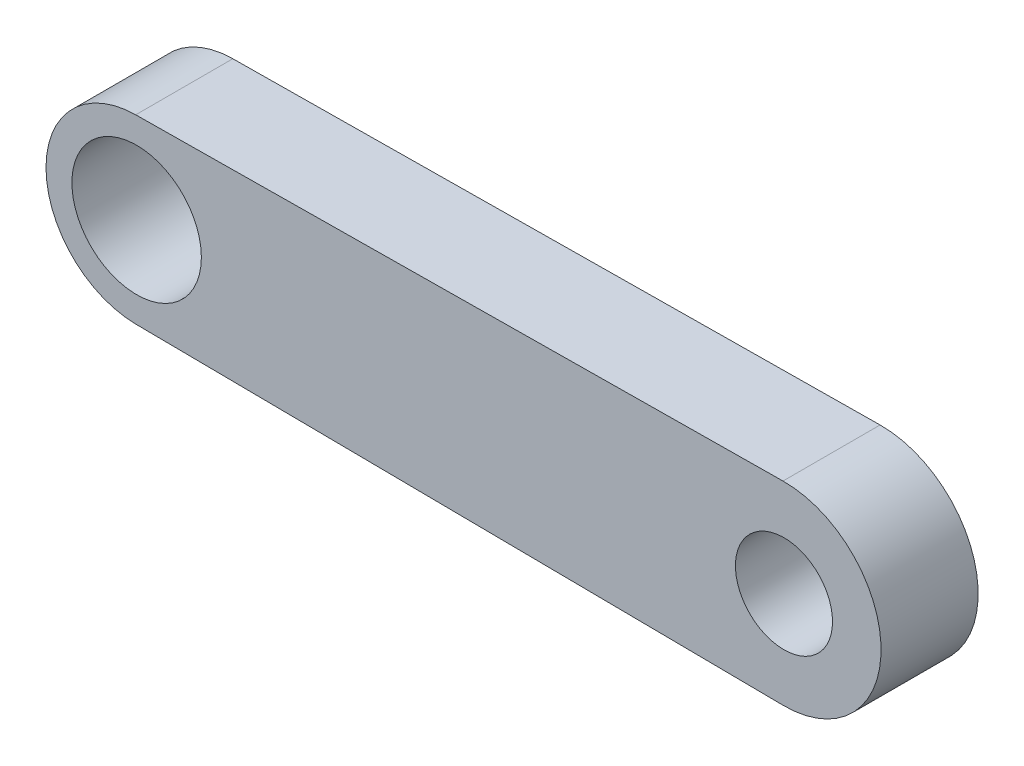
from build123d import *

# Parameters (mm, degrees)
ESQUISSE1_R        = 1.5
ESQUISSE1_R_2      = 2
BOSS_EXTRU_1_DEPTH = 3


with BuildPart() as part:
    # Esquisse1 → Boss.-Extru.1 (new body)
    with BuildSketch(Plane.XY):
        with BuildLine():
            Line((-0.028, 2.799859996), (19.97, 2.999849996))
            ThreePointArc((19.97, 2.999849996), (23, 0), (19.97, -2.999849996))
            Line((19.97, -2.999849996), (-0.028, -2.799859996))
            ThreePointArc((-0.028, -2.799859996), (-2.8, 0), (-0.028, 2.799859996))
        make_face()
        with Locations((20, 0)):
            Circle(ESQUISSE1_R, mode=Mode.SUBTRACT)
        Circle(ESQUISSE1_R_2, mode=Mode.SUBTRACT)
    extrude(amount=BOSS_EXTRU_1_DEPTH)


solid = part.part
